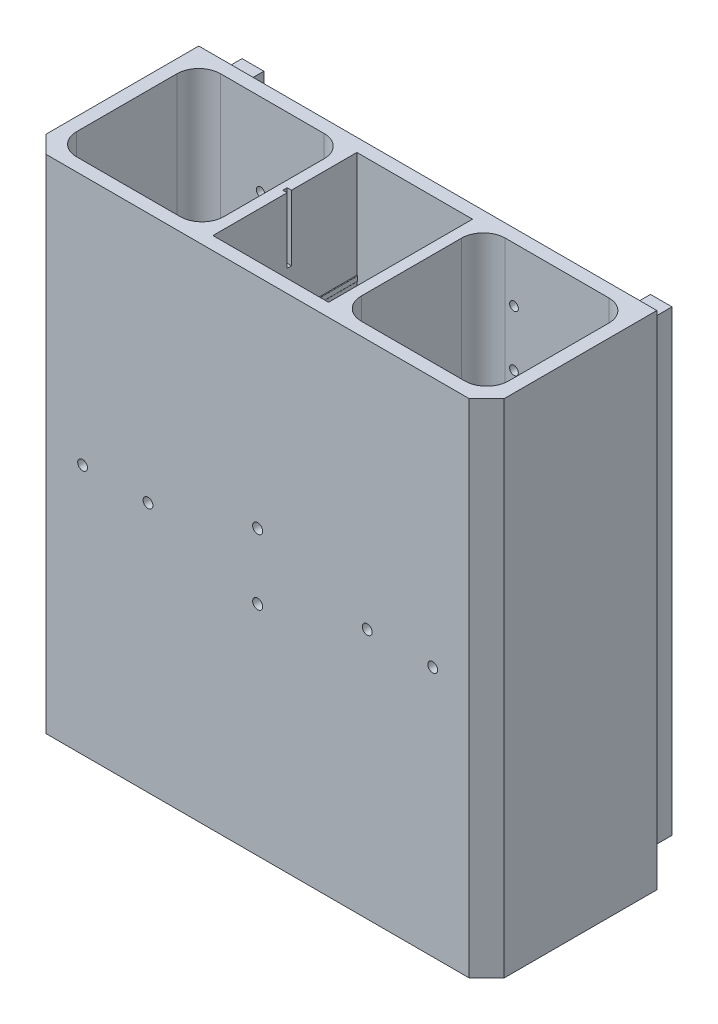
from build123d import *

# Parameters (mm, degrees)
SKETCH_1_W           = 210
SKETCH_1_H           = 230
EXTRUDE_1_DEPTH      = 6
SKETCH_2_W           = 9.85
SKETCH_2_H           = 209.85
SKETCH_2_W_2         = 10
EXTRUDE_3_DEPTH      = 15
SKETCH_3_R           = 2
CUT_EXTRUDE_1_DEPTH  = 10
SKETCH_17_W          = 6
SKETCH_17_H          = 230
EXTRUDE_9_DEPTH      = 66
EXTRUDE_10_DEPTH     = 6
CHAMFER_3_SIZE       = 8
SKETCH_19_W          = 5
SKETCH_19_H          = 230
EXTRUDE_11_DEPTH     = 66
FILLET_4_R           = 10
SKETCH_21_R          = 2.3
CUT_EXTRUDE_9_DEPTH  = 6
EXTRUDE_13_DEPTH     = 66
SKETCH_28_W          = 53
SKETCH_28_H          = 3
EXTRUDE_14_DEPTH     = 66
SKETCH_30_W          = 2
SKETCH_30_H          = 2
CUT_EXTRUDE_10_DEPTH = 30
SKETCH_31_R          = 1.25
SKETCH_31_W          = 13
SKETCH_31_H          = 13
CUT_EXTRUDE_11_DEPTH = 316.06185361
SKETCH_32_W          = 12
SKETCH_32_H          = 10
CUT_EXTRUDE_12_DEPTH = 320.662321834
CUT_EXTRUDE_13_REACH = 278.182
SKETCH_33_W          = 20
SKETCH_33_H          = 8.46
SKETCH_34_R          = 2.25
CUT_EXTRUDE_14_DEPTH = 30
SKETCH_36_R          = 2.25
CUT_EXTRUDE_15_DEPTH = 30


with BuildPart() as part:
    # 草图1 → 凸台-拉伸1 (new body)
    with BuildSketch(Plane.XY):
        with Locations((105, 115)):
            Rectangle(SKETCH_1_W, SKETCH_1_H)
    extrude(amount=EXTRUDE_1_DEPTH)

    # 草图2 → 凸台-拉伸3 (add)
    with BuildSketch(Plane(origin=(0, 0, 0), x_dir=(-1, 0, 0), z_dir=(0, 0, -1))):
        with Locations((-197, 115)):
            Rectangle(SKETCH_2_W, SKETCH_2_H)
        with Locations((-9.85, 115)):
            Rectangle(SKETCH_2_W_2, SKETCH_2_H)
    extrude(amount=EXTRUDE_3_DEPTH)

    # 草图3 → 切除-拉伸1 (cut)
    with BuildSketch(Plane(origin=(0, 0, 0), x_dir=(-1, 0, 0), z_dir=(0, 0, -1))):
        with Locations((-169.6425573, 192.25)):
            Circle(SKETCH_3_R)
        with Locations((-150.5, 205)):
            Circle(SKETCH_3_R)
        with Locations((-150.5, 179.5)):
            Circle(SKETCH_3_R)
        with Locations(Location((-150.5, 50.5, 0), (0, 0, 180))):
            Circle(SKETCH_3_R)
        with Locations(Location((-150.5, 25, 0), (0, 0, 180))):
            Circle(SKETCH_3_R)
        with Locations(Location((-169.6425573, 37.75, 0), (0, 0, 180))):
            Circle(SKETCH_3_R)
        with Locations((-34.3574427, 192.25)):
            Circle(SKETCH_3_R)
        with Locations((-53.5, 205)):
            Circle(SKETCH_3_R)
        with Locations((-53.5, 179.5)):
            Circle(SKETCH_3_R)
        with Locations(Location((-53.5, 50.5, 0), (0, 0, 180))):
            Circle(SKETCH_3_R)
        with Locations(Location((-53.5, 25, 0), (0, 0, 180))):
            Circle(SKETCH_3_R)
        with Locations(Location((-34.3574427, 37.75, 0), (0, 0, 180))):
            Circle(SKETCH_3_R)
    extrude(amount=-CUT_EXTRUDE_1_DEPTH, mode=Mode.SUBTRACT)

    # 草图17 → 凸台-拉伸9 (add)
    with BuildSketch(Plane.XY.offset(6)):
        with Locations((3, 115)):
            Rectangle(SKETCH_17_W, SKETCH_17_H)
        with Locations((207, 115)):
            Rectangle(SKETCH_17_W, SKETCH_17_H)
    extrude(amount=EXTRUDE_9_DEPTH)

    # 草图18 → 凸台-拉伸10 (add)
    with BuildSketch(Plane.XY.offset(72)):
        Polygon((210, 230), (204, 230), (6, 230), (0, 230), (0, 0), (6, 0), (204, 0), (210, 0), align=None)
    extrude(amount=EXTRUDE_10_DEPTH)

    # 倒角3
    chamfer_3_edges = [part.edges().sort_by_distance(p)[0] for p in [
        (210, 115, 78),
        (0, 115, 78),
    ]]
    chamfer(chamfer_3_edges, length=CHAMFER_3_SIZE)

    # 草图19 → 凸台-拉伸11 (add)
    with BuildSketch(Plane(origin=(0, 0, 72), x_dir=(-1, 0, 0), z_dir=(0, 0, -1))):
        with Locations((-134, 115)):
            Rectangle(SKETCH_19_W, SKETCH_19_H)
        with Locations((-76, 115)):
            Rectangle(SKETCH_19_W, SKETCH_19_H)
    extrude(amount=EXTRUDE_11_DEPTH)

    # 圆角4
    fillet_4_edges = [part.edges().sort_by_distance(p)[0] for p in [
        (6, 115, 6),
        (6, 115, 72),
        (204, 115, 6),
        (204, 115, 72),
        (73.5, 115, 6),
        (73.5, 115, 72),
        (136.5, 115, 72),
        (136.5, 115, 6),
    ]]
    fillet(fillet_4_edges, radius=FILLET_4_R)

    # 草图21 → 切除-拉伸9 (cut)
    with BuildSketch(Plane.XY.offset(72)):
        with Locations((105, 130)):
            Circle(SKETCH_21_R)
        with Locations((105, 100)):
            Circle(SKETCH_21_R)
    extrude(amount=CUT_EXTRUDE_9_DEPTH, mode=Mode.SUBTRACT)

    # 草图26 → 凸台-拉伸13 (add)
    with BuildSketch(Plane(origin=(0, 0, 72), x_dir=(-1, 0, 0), z_dir=(0, 0, -1))):
        with BuildLine():
            Line((-131.26, 181), (-131.26, 179))
            ThreePointArc((-131.26, 179), (-131.5, 178.76), (-131.74, 179))
            Line((-131.74, 179), (-131.74, 181))
            ThreePointArc((-131.74, 181), (-131.5, 181.24), (-131.26, 181))
        make_face()
        with BuildLine():
            Line((-131.26, 22.5), (-131.26, 20.5))
            ThreePointArc((-131.26, 20.5), (-131.5, 20.26), (-131.74, 20.5))
            Line((-131.74, 20.5), (-131.74, 22.5))
            ThreePointArc((-131.74, 22.5), (-131.5, 22.74), (-131.26, 22.5))
        make_face()
    extrude_13 = extrude(amount=EXTRUDE_13_DEPTH)

    # 镜向2: 凸台-拉伸13 across plane
    add(extrude_13.mirror(Plane.ZY.offset(-105)))

    # 草图28 → 凸台-拉伸14 (add)
    with BuildSketch(Plane(origin=(0, 0, 72), x_dir=(-1, 0, 0), z_dir=(0, 0, -1))):
        with Locations((-105, 9.96)):
            Rectangle(SKETCH_28_W, SKETCH_28_H)
    extrude(amount=EXTRUDE_14_DEPTH)

    # 草图30 → 切除-拉伸10 (cut)
    with BuildSketch(Plane(origin=(0, 230, 0), x_dir=(1, 0, 0), z_dir=(0, 1, 0))):
        with Locations((77.5, -37)):
            Rectangle(SKETCH_30_W, SKETCH_30_H)
    extrude(amount=-CUT_EXTRUDE_10_DEPTH, mode=Mode.SUBTRACT)

    # 草图31 → 切除-拉伸11 (cut, through all)
    with BuildSketch(Plane.XZ.offset(-8.46)):
        with Locations((92.7, 15.7)):
            Circle(SKETCH_31_R)
        with Locations((117.3, 15.7)):
            Circle(SKETCH_31_R)
        with Locations((105, 15.7)):
            Rectangle(SKETCH_31_W, SKETCH_31_H)
    extrude(amount=-CUT_EXTRUDE_11_DEPTH, mode=Mode.SUBTRACT)

    # 草图32 → 切除-拉伸12 (cut, through all)
    with BuildSketch(Plane.XY.offset(6)):
        with Locations((125.5, 3.46)):
            Rectangle(SKETCH_32_W, SKETCH_32_H)
    extrude(amount=-CUT_EXTRUDE_12_DEPTH, mode=Mode.SUBTRACT)

    # 草图33 → 切除-拉伸13 (cut, up to next)
    with BuildSketch(Plane.ZY.offset(-131.5), mode=Mode.PRIVATE) as cut_extrude_13_sk1:
        with Locations((40, 4.23)):
            Rectangle(SKETCH_33_W, SKETCH_33_H)
    cut_extrude_13_tool1 = extrude(cut_extrude_13_sk1.sketch, amount=-CUT_EXTRUDE_13_REACH, mode=Mode.PRIVATE) & part.part
    add(cut_extrude_13_tool1.solids().sort_by_distance((131.5, 4.23, 40))[0], mode=Mode.SUBTRACT)

    # 草图34 → 切除-拉伸14 (cut)
    with BuildSketch(Plane(origin=(0, 0, 72), x_dir=(-1, 0, 0), z_dir=(0, 0, -1))):
        with Locations((-185.25, 115)):
            Circle(SKETCH_34_R)
        with Locations((-155.25, 115)):
            Circle(SKETCH_34_R)
    extrude(amount=-CUT_EXTRUDE_14_DEPTH, mode=Mode.SUBTRACT)

    # 草图36 → 切除-拉伸15 (cut)
    with BuildSketch(Plane(origin=(0, 0, 72), x_dir=(-1, 0, 0), z_dir=(0, 0, -1))):
        with Locations((-54.75, 115)):
            Circle(SKETCH_36_R)
        with Locations((-24.75, 115)):
            Circle(SKETCH_36_R)
    extrude(amount=-CUT_EXTRUDE_15_DEPTH, mode=Mode.SUBTRACT)


solid = part.part
